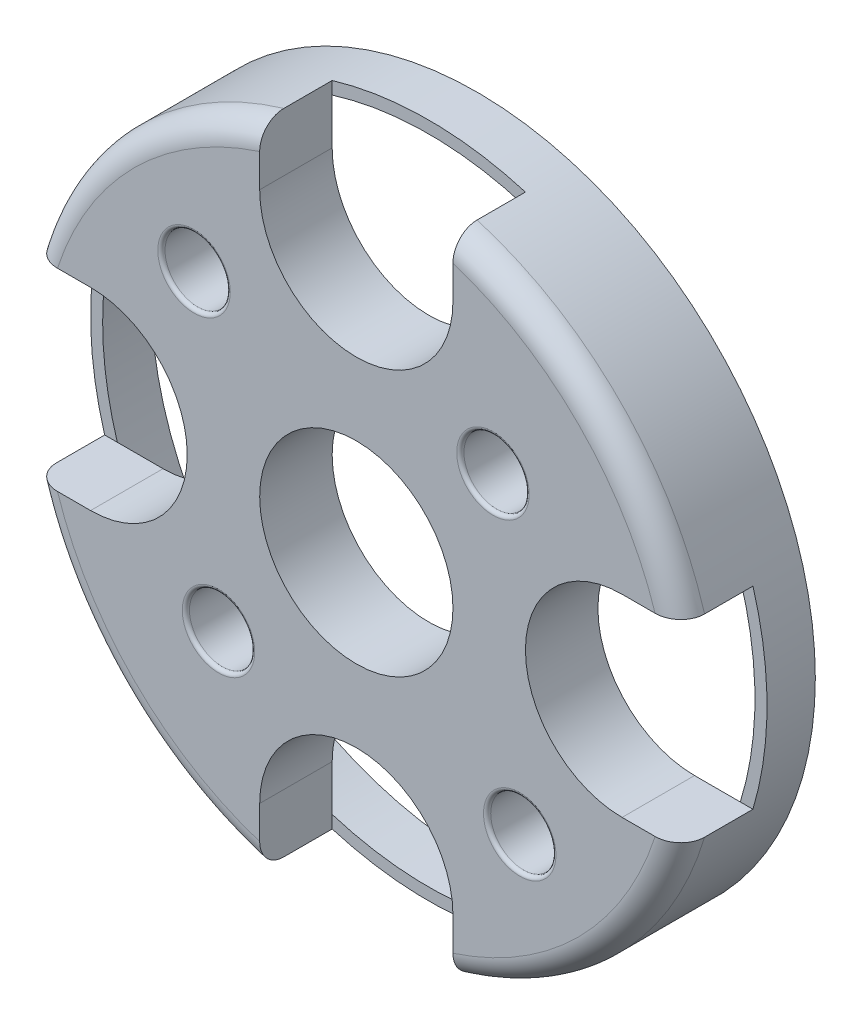
from build123d import *

# Parameters (mm, degrees)
SKETCH1_R                                         = 14
SKETCH1_R_2                                       = 4
SKETCH1_R_3                                       = 1.5
BOSS_EXTRUDE1_DEPTH                               = 5
CUT_EXTRUDE4_START                                = -3
CUT_EXTRUDE4_DEPTH                                = 3
SKETCH14_R                                        = 13.5
CUT_EXTRUDE5_DEPTH                                = 2
FILLET2_R                                         = 1
BOSS_EXTRUDE2_DEPTH                               = 1
BOSS_EXTRUDE2_DEPTH_BACK                          = 3
SKETCH16_R                                        = 1.5
BOSS_EXTRUDE4_DEPTH                               = 1
BOSS_EXTRUDE4_DEPTH_BACK                          = 3
SKETCH17_R                                        = 1.5
SKETCH17_R_2                                      = 1.550441812
SKETCH17_R_3                                      = 1.546716968
CSK_FOR_M2_5_FLAT_HEAD_MACHINE_SCREW1_D           = 2.7
CSK_FOR_M2_5_FLAT_HEAD_MACHINE_SCREW1_CSINK_D     = 5.5
CSK_FOR_M2_5_FLAT_HEAD_MACHINE_SCREW1_CSINK_ANGLE = 90
CSK_FOR_M2_5_FLAT_HEAD_MACHINE_SCREW2_D           = 2.7
CSK_FOR_M2_5_FLAT_HEAD_MACHINE_SCREW2_CSINK_D     = 5.5
CSK_FOR_M2_5_FLAT_HEAD_MACHINE_SCREW2_CSINK_ANGLE = 90
CSK_FOR_M2_5_FLAT_HEAD_MACHINE_SCREW3_D           = 2.7
CSK_FOR_M2_5_FLAT_HEAD_MACHINE_SCREW3_CSINK_D     = 5.5
CSK_FOR_M2_5_FLAT_HEAD_MACHINE_SCREW3_CSINK_ANGLE = 90
CSK_FOR_M2_5_FLAT_HEAD_MACHINE_SCREW4_D           = 2.7
CSK_FOR_M2_5_FLAT_HEAD_MACHINE_SCREW4_CSINK_D     = 5.5
CSK_FOR_M2_5_FLAT_HEAD_MACHINE_SCREW4_CSINK_ANGLE = 90
FILLET3_R                                         = 0.15


with BuildPart() as part:
    # Sketch1 → Boss-Extrude1 (new body)
    with BuildSketch(Plane.XY):
        Circle(SKETCH1_R)
        Circle(SKETCH1_R_2, mode=Mode.SUBTRACT)
        with Locations((-5.656854249, -5.656854249)):
            Circle(SKETCH1_R_3, mode=Mode.SUBTRACT)
        with Locations((5.656854249, 5.656854249)):
            Circle(SKETCH1_R_3, mode=Mode.SUBTRACT)
        with Locations((6.717514421, -6.717514421)):
            Circle(SKETCH1_R_3, mode=Mode.SUBTRACT)
        with Locations((-6.717514421, 6.717514421)):
            Circle(SKETCH1_R_3, mode=Mode.SUBTRACT)
    extrude(amount=BOSS_EXTRUDE1_DEPTH)

    # Sketch13 → Cut-Extrude4 (cut)
    with BuildSketch(Plane.XY.offset(5).offset(CUT_EXTRUDE4_START)):
        with BuildLine():
            Line((-11, 4), (-13.416407865, 4))
            ThreePointArc((-13.416407865, 4), (-14, 0), (-13.416407865, -4))
            Line((-13.416407865, -4), (-11, -4))
            ThreePointArc((-11, -4), (-7, 0), (-11, 4))
        make_face()
        with BuildLine():
            Line((4, 11), (4, 13.416407865))
            ThreePointArc((4, 13.416407865), (0, 14), (-4, 13.416407865))
            Line((-4, 13.416407865), (-4, 11))
            ThreePointArc((-4, 11), (0, 7), (4, 11))
        make_face()
        with BuildLine():
            Line((11, -4), (13.416407865, -4))
            ThreePointArc((13.416407865, -4), (14, 0), (13.416407865, 4))
            Line((13.416407865, 4), (11, 4))
            ThreePointArc((11, 4), (7, 0), (11, -4))
        make_face()
        with BuildLine():
            Line((-4, -11), (-4, -13.416407865))
            ThreePointArc((-4, -13.416407865), (0, -14), (4, -13.416407865))
            Line((4, -13.416407865), (4, -11))
            ThreePointArc((4, -11), (0, -7), (-4, -11))
        make_face()
    extrude(amount=CUT_EXTRUDE4_DEPTH, mode=Mode.SUBTRACT)

    # Sketch14 → Cut-Extrude5 (cut)
    with BuildSketch(Plane(origin=(0, 0, 0), x_dir=(-1, 0, 0), z_dir=(0, 0, -1))):
        Circle(SKETCH14_R)
    extrude(amount=-CUT_EXTRUDE5_DEPTH, mode=Mode.SUBTRACT)

    # Fillet2
    fillet2_edges = [part.edges().sort_by_distance(p)[0] for p in [
        (-9.899494937, -9.899494937, 5),
        (-9.899494937, 9.899494937, 5),
        (9.899494937, 9.899494937, 5),
        (9.899494937, -9.899494937, 5),
    ]]
    fillet(fillet2_edges, radius=FILLET2_R)

    # Sketch16 → Boss-Extrude2 (add, two sides: drawn at the far end of the back side and taken through both)
    with BuildSketch(Plane(origin=(0, 0, 2), x_dir=(-1, 0, 0), z_dir=(0, 0, -1)).offset(-BOSS_EXTRUDE2_DEPTH_BACK)):
        with Locations((6.717514421, 6.717514421)):
            Circle(SKETCH16_R)
    extrude(amount=BOSS_EXTRUDE2_DEPTH + BOSS_EXTRUDE2_DEPTH_BACK)

    # Sketch17 → Boss-Extrude4 (add, two sides: drawn at the far end of the back side and taken through both)
    with BuildSketch(Plane(origin=(0, 0, 2), x_dir=(-1, 0, 0), z_dir=(0, 0, -1)).offset(-BOSS_EXTRUDE4_DEPTH_BACK)):
        with Locations((-5.656854249, 5.656854249)):
            Circle(SKETCH17_R)
        with Locations((5.704995791, -5.671913081)):
            Circle(SKETCH17_R_2)
        with Locations((-6.763543143, -6.725503911)):
            Circle(SKETCH17_R_3)
    extrude(amount=BOSS_EXTRUDE4_DEPTH + BOSS_EXTRUDE4_DEPTH_BACK)

    # CSK for M2.5 Flat Head Machine Screw1 (through all)
    with Locations(Plane(origin=(-6.717514421, 6.717514421, 1), x_dir=(-1, 0, 0), z_dir=(0, 0, -1))):
        with Locations((0, 0)):
            CounterSinkHole(CSK_FOR_M2_5_FLAT_HEAD_MACHINE_SCREW1_D / 2, CSK_FOR_M2_5_FLAT_HEAD_MACHINE_SCREW1_CSINK_D / 2, counter_sink_angle=CSK_FOR_M2_5_FLAT_HEAD_MACHINE_SCREW1_CSINK_ANGLE)

    # CSK for M2.5 Flat Head Machine Screw2 (through all)
    with Locations(Plane(origin=(5.656854249, 5.656854249, 1), x_dir=(-1, 0, 0), z_dir=(0, 0, -1))):
        with Locations((0, 0)):
            CounterSinkHole(CSK_FOR_M2_5_FLAT_HEAD_MACHINE_SCREW2_D / 2, CSK_FOR_M2_5_FLAT_HEAD_MACHINE_SCREW2_CSINK_D / 2, counter_sink_angle=CSK_FOR_M2_5_FLAT_HEAD_MACHINE_SCREW2_CSINK_ANGLE)

    # CSK for M2.5 Flat Head Machine Screw3 (through all)
    with Locations(Plane(origin=(6.763543143, -6.725503911, 1), x_dir=(-1, 0, 0), z_dir=(0, 0, -1))):
        with Locations((0, 0)):
            CounterSinkHole(CSK_FOR_M2_5_FLAT_HEAD_MACHINE_SCREW3_D / 2, CSK_FOR_M2_5_FLAT_HEAD_MACHINE_SCREW3_CSINK_D / 2, counter_sink_angle=CSK_FOR_M2_5_FLAT_HEAD_MACHINE_SCREW3_CSINK_ANGLE)

    # CSK for M2.5 Flat Head Machine Screw4 (through all)
    with Locations(Plane(origin=(-5.704995791, -5.671913081, 1), x_dir=(-1, 0, 0), z_dir=(0, 0, -1))):
        with Locations((0, 0)):
            CounterSinkHole(CSK_FOR_M2_5_FLAT_HEAD_MACHINE_SCREW4_D / 2, CSK_FOR_M2_5_FLAT_HEAD_MACHINE_SCREW4_CSINK_D / 2, counter_sink_angle=CSK_FOR_M2_5_FLAT_HEAD_MACHINE_SCREW4_CSINK_ANGLE)

    # Fillet3
    fillet3_edges = [part.edges().sort_by_distance(p)[0] for p in [
        (-8.067514421, 6.717514421, 5),
        (4.306854249, 5.656854249, 5),
        (5.413543143, -6.725503911, 5),
        (-7.054995791, -5.671913081, 5),
    ]]
    fillet(fillet3_edges, radius=FILLET3_R)


solid = part.part
